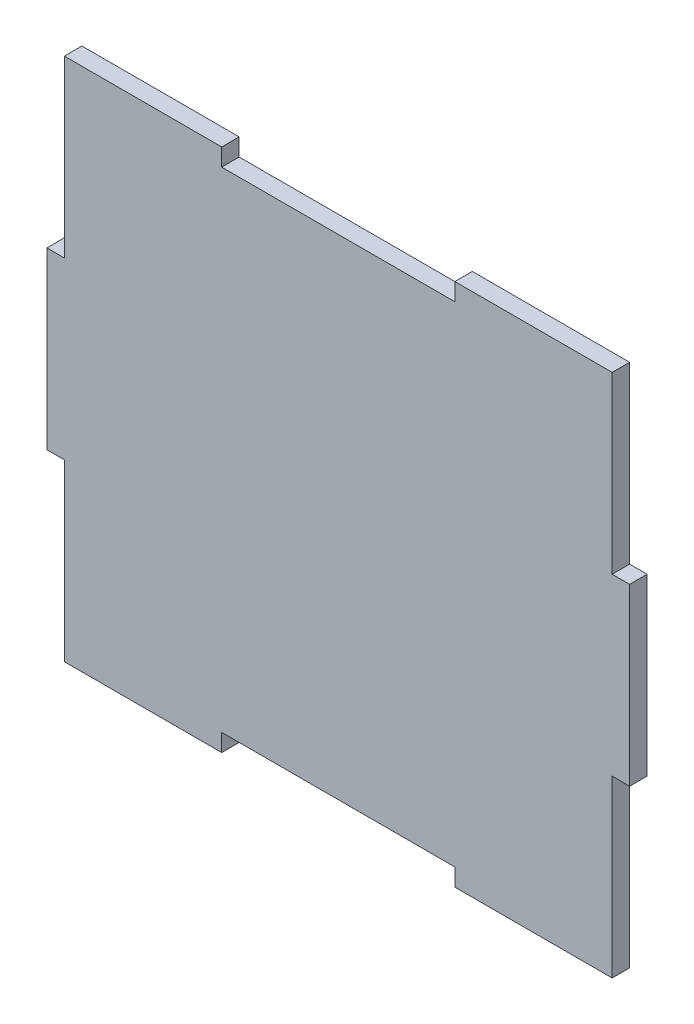
from build123d import *

# Parameters (mm, degrees)
ESQUISSE1_W             = 100
ESQUISSE1_H             = 90
BOSS_EXTRU_1_DEPTH      = 3
ENL_V_MAT_EXTRU_1_REACH = 90.04
ESQUISSE2_W             = 40
ESQUISSE2_H             = 3
ESQUISSE2_W_2           = 3
ESQUISSE2_H_2           = 30


with BuildPart() as part:
    # Esquisse1 → Boss.-Extru.1 (new body)
    with BuildSketch(Plane.XY):
        with Locations((-10.038524431, -19.32304038)):
            Rectangle(ESQUISSE1_W, ESQUISSE1_H)
    extrude(amount=BOSS_EXTRU_1_DEPTH)

    # Esquisse2 → Enlèv. mat.-Extru.1 (cut, up to next)
    with BuildSketch(Plane.XY.offset(3), mode=Mode.PRIVATE) as enl_v_mat_extru_1_sk1:
        with Locations((-10.038524431, 24.17695962)):
            Rectangle(ESQUISSE2_W, ESQUISSE2_H)
    enl_v_mat_extru_1_tool1 = extrude(enl_v_mat_extru_1_sk1.sketch, amount=-ENL_V_MAT_EXTRU_1_REACH, mode=Mode.PRIVATE) & part.part
    # Esquisse2 → Enlèv. mat.-Extru.1 (cut, up to next)
    with BuildSketch(Plane.XY.offset(3), mode=Mode.PRIVATE) as enl_v_mat_extru_1_sk2:
        with Locations((-58.538524431, 10.67695962)):
            Rectangle(ESQUISSE2_W_2, ESQUISSE2_H_2)
    enl_v_mat_extru_1_tool2 = extrude(enl_v_mat_extru_1_sk2.sketch, amount=-ENL_V_MAT_EXTRU_1_REACH, mode=Mode.PRIVATE) & part.part
    # Esquisse2 → Enlèv. mat.-Extru.1 (cut, up to next)
    with BuildSketch(Plane.XY.offset(3), mode=Mode.PRIVATE) as enl_v_mat_extru_1_sk3:
        with Locations((-58.538524431, -49.32304038)):
            Rectangle(ESQUISSE2_W_2, ESQUISSE2_H_2)
    enl_v_mat_extru_1_tool3 = extrude(enl_v_mat_extru_1_sk3.sketch, amount=-ENL_V_MAT_EXTRU_1_REACH, mode=Mode.PRIVATE) & part.part
    # Esquisse2 → Enlèv. mat.-Extru.1 (cut, up to next)
    with BuildSketch(Plane.XY.offset(3), mode=Mode.PRIVATE) as enl_v_mat_extru_1_sk4:
        with Locations((-10.038524431, -62.82304038)):
            Rectangle(ESQUISSE2_W, ESQUISSE2_H)
    enl_v_mat_extru_1_tool4 = extrude(enl_v_mat_extru_1_sk4.sketch, amount=-ENL_V_MAT_EXTRU_1_REACH, mode=Mode.PRIVATE) & part.part
    # Esquisse2 → Enlèv. mat.-Extru.1 (cut, up to next)
    with BuildSketch(Plane.XY.offset(3), mode=Mode.PRIVATE) as enl_v_mat_extru_1_sk5:
        with Locations((38.461475569, -49.32304038)):
            Rectangle(ESQUISSE2_W_2, ESQUISSE2_H_2)
    enl_v_mat_extru_1_tool5 = extrude(enl_v_mat_extru_1_sk5.sketch, amount=-ENL_V_MAT_EXTRU_1_REACH, mode=Mode.PRIVATE) & part.part
    # Esquisse2 → Enlèv. mat.-Extru.1 (cut, up to next)
    with BuildSketch(Plane.XY.offset(3), mode=Mode.PRIVATE) as enl_v_mat_extru_1_sk6:
        with Locations((38.461475569, 10.67695962)):
            Rectangle(ESQUISSE2_W_2, ESQUISSE2_H_2)
    enl_v_mat_extru_1_tool6 = extrude(enl_v_mat_extru_1_sk6.sketch, amount=-ENL_V_MAT_EXTRU_1_REACH, mode=Mode.PRIVATE) & part.part
    add(enl_v_mat_extru_1_tool1.solids().sort_by_distance((-10.038524, 24.17696, 3))[0], mode=Mode.SUBTRACT)
    add(enl_v_mat_extru_1_tool2.solids().sort_by_distance((-58.538524, 10.67696, 3))[0], mode=Mode.SUBTRACT)
    add(enl_v_mat_extru_1_tool3.solids().sort_by_distance((-58.538524, -49.32304, 3))[0], mode=Mode.SUBTRACT)
    add(enl_v_mat_extru_1_tool4.solids().sort_by_distance((-10.038524, -62.82304, 3))[0], mode=Mode.SUBTRACT)
    add(enl_v_mat_extru_1_tool5.solids().sort_by_distance((38.461476, -49.32304, 3))[0], mode=Mode.SUBTRACT)
    add(enl_v_mat_extru_1_tool6.solids().sort_by_distance((38.461476, 10.67696, 3))[0], mode=Mode.SUBTRACT)


solid = part.part
